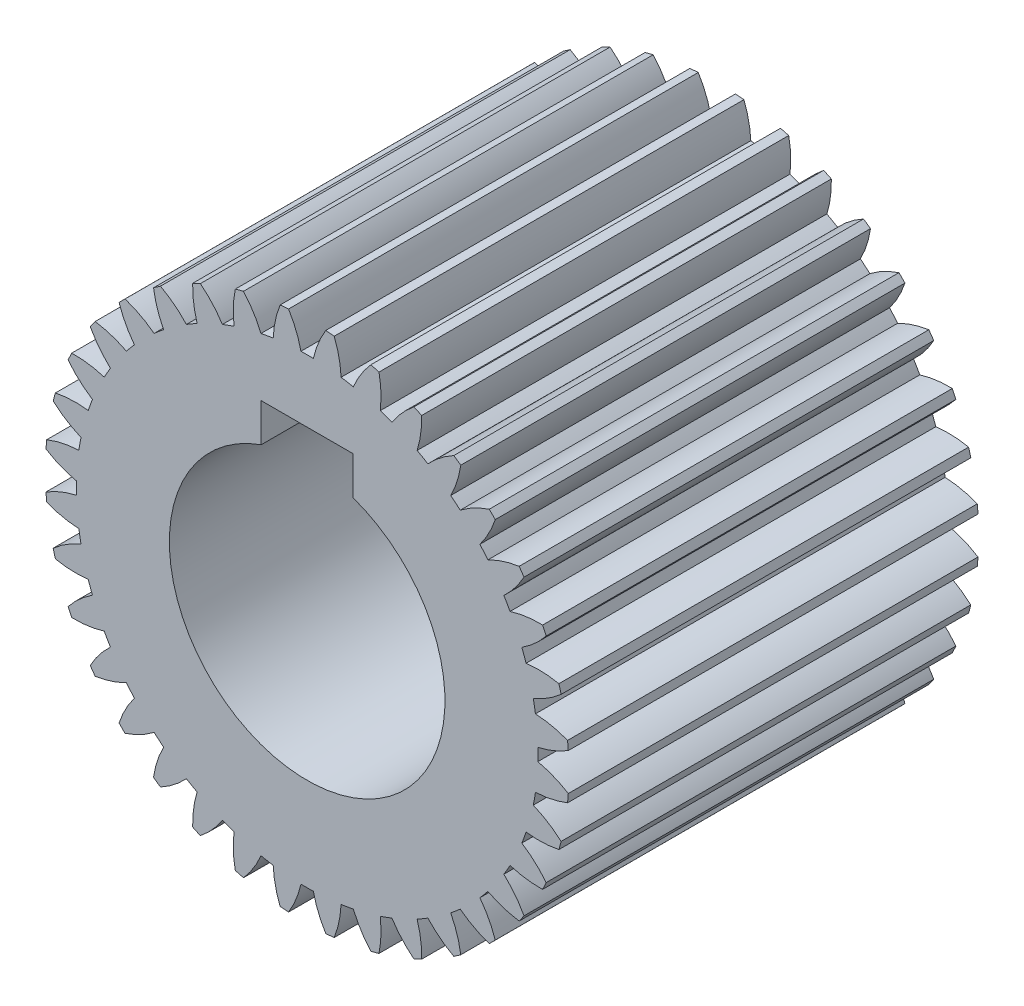
from build123d import *

# Parameters (mm, degrees)
EXTRUDE_1_DEPTH = 44.6


with BuildPart() as part:
    # Model → 凸台-拉伸1 (new body)
    with BuildSketch(Plane.XY):
        with BuildLine():
            ThreePointArc((25.114914919, 0.675592044), (26.827682547, 1.211341733), (28.42808806, 2.023316406))
            ThreePointArc((28.42808806, 2.023316406), (28.391548896, 2.483938668), (28.347546731, 2.943908003))
            ThreePointArc((28.347546731, 2.943908003), (26.630457052, 3.465639455), (24.850678256, 3.695830925))
            ThreePointArc((24.850678256, 3.695830925), (24.742309987, 4.362736816), (24.616047601, 5.026487491))
            ThreePointArc((24.616047601, 5.026487491), (26.209762483, 5.851516916), (27.644856318, 6.929063369))
            ThreePointArc((27.644856318, 6.929063369), (27.528886049, 7.376342785), (27.40567954, 7.821683257))
            ThreePointArc((27.40567954, 7.821683257), (25.624078595, 8.037318942), (23.831366309, 7.954957942))
            ThreePointArc((23.831366309, 7.954957942), (23.608837405, 8.592914081), (23.369234133, 9.224655658))
            ThreePointArc((23.369234133, 9.224655658), (24.795472049, 10.313896717), (26.021649606, 11.624274249))
            ThreePointArc((26.021649606, 11.624274249), (25.829771931, 12.04462046), (25.631104644, 12.461800622))
            ThreePointArc((25.631104644, 12.461800622), (23.839125477, 12.36478856), (22.087950356, 11.972377587))
            ThreePointArc((22.087950356, 11.972377587), (21.758022245, 12.562), (21.412358312, 13.142537332))
            ThreePointArc((21.412358312, 13.142537332), (22.627783743, 14.462893987), (23.607788238, 15.966287437))
            ThreePointArc((23.607788238, 15.966287437), (23.345833262, 16.346928436), (23.077741603, 16.723272482))
            ThreePointArc((23.077741603, 16.723272482), (21.329832594, 16.316560334), (19.673403208, 15.626022597))
            ThreePointArc((19.673403208, 15.626022597), (19.246100589, 16.149395906), (18.804878818, 16.661089659))
            ThreePointArc((18.804878818, 16.661089659), (19.772561679, 18.172443541), (20.47661617, 19.823173061))
            ThreePointArc((20.47661617, 19.823173061), (20.152543264, 20.152543264), (19.823173061, 20.47661617))
            ThreePointArc((19.823173061, 20.47661617), (18.172443541, 19.772561679), (16.661089659, 18.804878818))
            ThreePointArc((16.661089659, 18.804878818), (16.149395906, 19.246100589), (15.626022597, 19.673403208))
            ThreePointArc((15.626022597, 19.673403208), (16.316560334, 21.329832594), (16.723272482, 23.077741603))
            ThreePointArc((16.723272482, 23.077741603), (16.346928436, 23.345833262), (15.966287437, 23.607788238))
            ThreePointArc((15.966287437, 23.607788238), (14.462893987, 22.627783743), (13.142537332, 21.412358312))
            ThreePointArc((13.142537332, 21.412358312), (12.562, 21.758022245), (11.972377587, 22.087950356))
            ThreePointArc((11.972377587, 22.087950356), (12.36478856, 23.839125477), (12.461800622, 25.631104643))
            ThreePointArc((12.461800622, 25.631104643), (12.04462046, 25.829771931), (11.624274249, 26.021649606))
            ThreePointArc((11.624274249, 26.021649606), (10.313896717, 24.795472049), (9.224655658, 23.369234133))
            ThreePointArc((9.224655658, 23.369234133), (8.592914081, 23.608837405), (7.954957942, 23.831366309))
            ThreePointArc((7.954957942, 23.831366309), (8.037318942, 25.624078595), (7.821683257, 27.40567954))
            ThreePointArc((7.821683257, 27.40567954), (7.376342785, 27.528886049), (6.929063369, 27.644856318))
            ThreePointArc((6.929063369, 27.644856318), (5.851516916, 26.209762483), (5.026487491, 24.616047601))
            ThreePointArc((5.026487491, 24.616047601), (4.362736816, 24.742309987), (3.695830925, 24.850678256))
            ThreePointArc((3.695830925, 24.850678256), (3.465639455, 26.630457052), (2.943908003, 28.347546731))
            ThreePointArc((2.943908003, 28.347546731), (2.483938668, 28.391548896), (2.023316406, 28.42808806))
            ThreePointArc((2.023316406, 28.42808806), (1.211341733, 26.827682547), (0.675592044, 25.114914919))
            ThreePointArc((0.675592044, 25.114914919), (0, 25.124), (-0.675592044, 25.114914919))
            ThreePointArc((-0.675592044, 25.114914919), (-1.211341733, 26.827682547), (-2.023316406, 28.42808806))
            ThreePointArc((-2.023316406, 28.42808806), (-2.483938668, 28.391548896), (-2.943908003, 28.347546731))
            ThreePointArc((-2.943908003, 28.347546731), (-3.465639455, 26.630457052), (-3.695830925, 24.850678256))
            ThreePointArc((-3.695830925, 24.850678256), (-4.362736816, 24.742309987), (-5.026487491, 24.616047601))
            ThreePointArc((-5.026487491, 24.616047601), (-5.851516916, 26.209762483), (-6.929063369, 27.644856318))
            ThreePointArc((-6.929063369, 27.644856318), (-7.376342785, 27.528886049), (-7.821683257, 27.40567954))
            ThreePointArc((-7.821683257, 27.40567954), (-8.037318942, 25.624078595), (-7.954957942, 23.831366309))
            ThreePointArc((-7.954957942, 23.831366309), (-8.592914081, 23.608837405), (-9.224655658, 23.369234133))
            ThreePointArc((-9.224655658, 23.369234133), (-10.313896717, 24.795472049), (-11.624274249, 26.021649606))
            ThreePointArc((-11.624274249, 26.021649606), (-12.04462046, 25.829771931), (-12.461800622, 25.631104644))
            ThreePointArc((-12.461800622, 25.631104644), (-12.36478856, 23.839125477), (-11.972377587, 22.087950356))
            ThreePointArc((-11.972377587, 22.087950356), (-12.562, 21.758022245), (-13.142537332, 21.412358312))
            ThreePointArc((-13.142537332, 21.412358312), (-14.462893987, 22.627783743), (-15.966287437, 23.607788238))
            ThreePointArc((-15.966287437, 23.607788238), (-16.346928436, 23.345833262), (-16.723272482, 23.077741603))
            ThreePointArc((-16.723272482, 23.077741603), (-16.316560334, 21.329832594), (-15.626022597, 19.673403208))
            ThreePointArc((-15.626022597, 19.673403208), (-16.149395906, 19.246100589), (-16.661089659, 18.804878818))
            ThreePointArc((-16.661089659, 18.804878818), (-18.172443541, 19.772561679), (-19.823173061, 20.47661617))
            ThreePointArc((-19.823173061, 20.47661617), (-20.152543264, 20.152543264), (-20.47661617, 19.823173061))
            ThreePointArc((-20.47661617, 19.823173061), (-19.772561679, 18.172443541), (-18.804878818, 16.661089659))
            ThreePointArc((-18.804878818, 16.661089659), (-19.246100589, 16.149395906), (-19.673403208, 15.626022597))
            ThreePointArc((-19.673403208, 15.626022597), (-21.329832594, 16.316560334), (-23.077741603, 16.723272482))
            ThreePointArc((-23.077741603, 16.723272482), (-23.345833262, 16.346928436), (-23.607788238, 15.966287437))
            ThreePointArc((-23.607788238, 15.966287437), (-22.627783743, 14.462893987), (-21.412358312, 13.142537332))
            ThreePointArc((-21.412358312, 13.142537332), (-21.758022245, 12.562), (-22.087950356, 11.972377587))
            ThreePointArc((-22.087950356, 11.972377587), (-23.839125477, 12.36478856), (-25.631104643, 12.461800622))
            ThreePointArc((-25.631104643, 12.461800622), (-25.829771931, 12.04462046), (-26.021649606, 11.624274249))
            ThreePointArc((-26.021649606, 11.624274249), (-24.795472049, 10.313896717), (-23.369234133, 9.224655658))
            ThreePointArc((-23.369234133, 9.224655658), (-23.608837405, 8.592914081), (-23.831366309, 7.954957942))
            ThreePointArc((-23.831366309, 7.954957942), (-25.624078595, 8.037318942), (-27.40567954, 7.821683257))
            ThreePointArc((-27.40567954, 7.821683257), (-27.528886049, 7.376342785), (-27.644856318, 6.929063369))
            ThreePointArc((-27.644856318, 6.929063369), (-26.209762483, 5.851516916), (-24.616047601, 5.026487491))
            ThreePointArc((-24.616047601, 5.026487491), (-24.742309987, 4.362736816), (-24.850678256, 3.695830925))
            ThreePointArc((-24.850678256, 3.695830925), (-26.630457052, 3.465639455), (-28.347546731, 2.943908003))
            ThreePointArc((-28.347546731, 2.943908003), (-28.391548896, 2.483938668), (-28.42808806, 2.023316406))
            ThreePointArc((-28.42808806, 2.023316406), (-26.827682547, 1.211341733), (-25.114914919, 0.675592044))
            ThreePointArc((-25.114914919, 0.675592044), (-25.124, 0), (-25.114914919, -0.675592044))
            ThreePointArc((-25.114914919, -0.675592044), (-26.827682547, -1.211341733), (-28.42808806, -2.023316406))
            ThreePointArc((-28.42808806, -2.023316406), (-28.391548896, -2.483938668), (-28.347546731, -2.943908003))
            ThreePointArc((-28.347546731, -2.943908003), (-26.630457052, -3.465639455), (-24.850678256, -3.695830925))
            ThreePointArc((-24.850678256, -3.695830925), (-24.742309987, -4.362736816), (-24.616047601, -5.026487491))
            ThreePointArc((-24.616047601, -5.026487491), (-26.209762483, -5.851516916), (-27.644856318, -6.929063369))
            ThreePointArc((-27.644856318, -6.929063369), (-27.528886049, -7.376342785), (-27.40567954, -7.821683257))
            ThreePointArc((-27.40567954, -7.821683257), (-25.624078595, -8.037318942), (-23.831366309, -7.954957942))
            ThreePointArc((-23.831366309, -7.954957942), (-23.608837405, -8.592914081), (-23.369234133, -9.224655658))
            ThreePointArc((-23.369234133, -9.224655658), (-24.795472049, -10.313896717), (-26.021649606, -11.624274249))
            ThreePointArc((-26.021649606, -11.624274249), (-25.829771931, -12.04462046), (-25.631104644, -12.461800622))
            ThreePointArc((-25.631104644, -12.461800622), (-23.839125477, -12.36478856), (-22.087950356, -11.972377587))
            ThreePointArc((-22.087950356, -11.972377587), (-21.758022245, -12.562), (-21.412358312, -13.142537332))
            ThreePointArc((-21.412358312, -13.142537332), (-22.627783743, -14.462893987), (-23.607788238, -15.966287437))
            ThreePointArc((-23.607788238, -15.966287437), (-23.345833262, -16.346928436), (-23.077741603, -16.723272482))
            ThreePointArc((-23.077741603, -16.723272482), (-21.329832594, -16.316560334), (-19.673403208, -15.626022597))
            ThreePointArc((-19.673403208, -15.626022597), (-19.246100589, -16.149395906), (-18.804878818, -16.661089659))
            ThreePointArc((-18.804878818, -16.661089659), (-19.772561679, -18.172443541), (-20.47661617, -19.823173061))
            ThreePointArc((-20.47661617, -19.823173061), (-20.152543264, -20.152543264), (-19.823173061, -20.47661617))
            ThreePointArc((-19.823173061, -20.47661617), (-18.172443541, -19.772561679), (-16.661089659, -18.804878818))
            ThreePointArc((-16.661089659, -18.804878818), (-16.149395906, -19.246100589), (-15.626022597, -19.673403208))
            ThreePointArc((-15.626022597, -19.673403208), (-16.316560334, -21.329832594), (-16.723272482, -23.077741603))
            ThreePointArc((-16.723272482, -23.077741603), (-16.346928436, -23.345833262), (-15.966287437, -23.607788238))
            ThreePointArc((-15.966287437, -23.607788238), (-14.462893987, -22.627783743), (-13.142537332, -21.412358312))
            ThreePointArc((-13.142537332, -21.412358312), (-12.562, -21.758022245), (-11.972377587, -22.087950356))
            ThreePointArc((-11.972377587, -22.087950356), (-12.36478856, -23.839125477), (-12.461800622, -25.631104643))
            ThreePointArc((-12.461800622, -25.631104643), (-12.04462046, -25.829771931), (-11.624274249, -26.021649606))
            ThreePointArc((-11.624274249, -26.021649606), (-10.313896717, -24.795472049), (-9.224655658, -23.369234133))
            ThreePointArc((-9.224655658, -23.369234133), (-8.592914081, -23.608837405), (-7.954957942, -23.831366309))
            ThreePointArc((-7.954957942, -23.831366309), (-8.037318942, -25.624078595), (-7.821683257, -27.40567954))
            ThreePointArc((-7.821683257, -27.40567954), (-7.376342785, -27.528886049), (-6.929063369, -27.644856318))
            ThreePointArc((-6.929063369, -27.644856318), (-5.851516916, -26.209762483), (-5.026487491, -24.616047601))
            ThreePointArc((-5.026487491, -24.616047601), (-4.362736816, -24.742309987), (-3.695830925, -24.850678256))
            ThreePointArc((-3.695830925, -24.850678256), (-3.465639455, -26.630457052), (-2.943908003, -28.347546731))
            ThreePointArc((-2.943908003, -28.347546731), (-2.483938668, -28.391548896), (-2.023316406, -28.42808806))
            ThreePointArc((-2.023316406, -28.42808806), (-1.211341733, -26.827682547), (-0.675592044, -25.114914919))
            ThreePointArc((-0.675592044, -25.114914919), (0, -25.124), (0.675592044, -25.114914919))
            ThreePointArc((0.675592044, -25.114914919), (1.211341733, -26.827682547), (2.023316406, -28.42808806))
            ThreePointArc((2.023316406, -28.42808806), (2.483938668, -28.391548896), (2.943908003, -28.347546731))
            ThreePointArc((2.943908003, -28.347546731), (3.465639455, -26.630457052), (3.695830925, -24.850678256))
            ThreePointArc((3.695830925, -24.850678256), (4.362736816, -24.742309987), (5.026487491, -24.616047601))
            ThreePointArc((5.026487491, -24.616047601), (5.851516916, -26.209762483), (6.929063369, -27.644856318))
            ThreePointArc((6.929063369, -27.644856318), (7.376342785, -27.528886049), (7.821683257, -27.40567954))
            ThreePointArc((7.821683257, -27.40567954), (8.037318942, -25.624078595), (7.954957942, -23.831366309))
            ThreePointArc((7.954957942, -23.831366309), (8.592914081, -23.608837405), (9.224655658, -23.369234133))
            ThreePointArc((9.224655658, -23.369234133), (10.313896717, -24.795472049), (11.624274249, -26.021649606))
            ThreePointArc((11.624274249, -26.021649606), (12.04462046, -25.829771931), (12.461800622, -25.631104644))
            ThreePointArc((12.461800622, -25.631104644), (12.36478856, -23.839125477), (11.972377587, -22.087950356))
            ThreePointArc((11.972377587, -22.087950356), (12.562, -21.758022245), (13.142537332, -21.412358312))
            ThreePointArc((13.142537332, -21.412358312), (14.462893987, -22.627783743), (15.966287437, -23.607788238))
            ThreePointArc((15.966287437, -23.607788238), (16.346928436, -23.345833262), (16.723272482, -23.077741603))
            ThreePointArc((16.723272482, -23.077741603), (16.316560334, -21.329832594), (15.626022597, -19.673403208))
            ThreePointArc((15.626022597, -19.673403208), (16.149395906, -19.246100589), (16.661089659, -18.804878818))
            ThreePointArc((16.661089659, -18.804878818), (18.172443541, -19.772561679), (19.823173061, -20.47661617))
            ThreePointArc((19.823173061, -20.47661617), (20.152543264, -20.152543264), (20.47661617, -19.823173061))
            ThreePointArc((20.47661617, -19.823173061), (19.772561679, -18.172443541), (18.804878818, -16.661089659))
            ThreePointArc((18.804878818, -16.661089659), (19.246100589, -16.149395906), (19.673403208, -15.626022597))
            ThreePointArc((19.673403208, -15.626022597), (21.329832594, -16.316560334), (23.077741603, -16.723272482))
            ThreePointArc((23.077741603, -16.723272482), (23.345833262, -16.346928436), (23.607788238, -15.966287437))
            ThreePointArc((23.607788238, -15.966287437), (22.627783743, -14.462893987), (21.412358312, -13.142537332))
            ThreePointArc((21.412358312, -13.142537332), (21.758022245, -12.562), (22.087950356, -11.972377587))
            ThreePointArc((22.087950356, -11.972377587), (23.839125477, -12.36478856), (25.631104643, -12.461800622))
            ThreePointArc((25.631104643, -12.461800622), (25.829771931, -12.04462046), (26.021649606, -11.624274249))
            ThreePointArc((26.021649606, -11.624274249), (24.795472049, -10.313896717), (23.369234133, -9.224655658))
            ThreePointArc((23.369234133, -9.224655658), (23.608837405, -8.592914081), (23.831366309, -7.954957942))
            ThreePointArc((23.831366309, -7.954957942), (25.624078595, -8.037318942), (27.40567954, -7.821683257))
            ThreePointArc((27.40567954, -7.821683257), (27.528886049, -7.376342785), (27.644856318, -6.929063369))
            ThreePointArc((27.644856318, -6.929063369), (26.209762483, -5.851516916), (24.616047601, -5.026487491))
            ThreePointArc((24.616047601, -5.026487491), (24.742309987, -4.362736816), (24.850678256, -3.695830925))
            ThreePointArc((24.850678256, -3.695830925), (26.630457052, -3.465639455), (28.347546731, -2.943908003))
            ThreePointArc((28.347546731, -2.943908003), (28.391548896, -2.483938668), (28.42808806, -2.023316406))
            ThreePointArc((28.42808806, -2.023316406), (26.827682547, -1.211341733), (25.114914919, -0.675592044))
            ThreePointArc((25.114914919, -0.675592044), (25.124, 0), (25.114914919, 0.675592044))
        make_face()
        with BuildLine():
            Line((-5, 18.3), (-5, 14.142135624))
            ThreePointArc((-5, 14.142135624), (0, -14.999999999), (5, 14.142135624))
            Line((5, 14.142135624), (5, 18.3))
            Line((5, 18.3), (-5, 18.3))
        make_face(mode=Mode.SUBTRACT)
    extrude(amount=EXTRUDE_1_DEPTH)


solid = part.part
